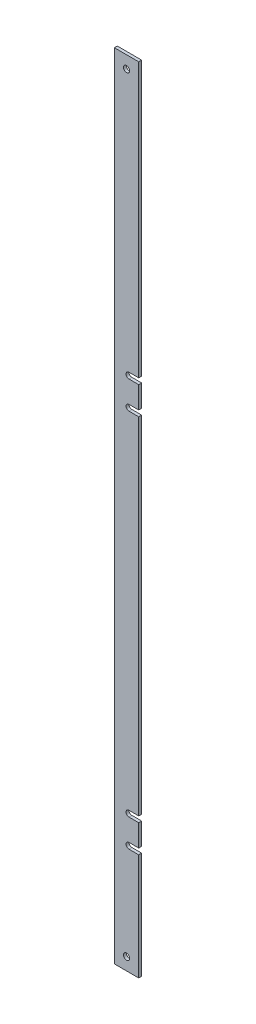
from build123d import *

# Parameters (mm, degrees)
SKETCH1_W                       = 25
SKETCH1_H                       = 812.8
BOSS_EXTRUDE1_DEPTH             = 3
CUT_EXTRUDE4_DEPTH              = 10
F_1_4_0_25_DIAMETER_HOLE1_D     = 6.35
F_1_4_0_25_DIAMETER_HOLE1_DEPTH = 5.84
F_1_4_0_25_DIAMETER_HOLE1_TIP   = 1.907732465


with BuildPart() as part:
    # Sketch1 → Boss-Extrude1 (new body)
    with BuildSketch(Plane.XY):
        Rectangle(SKETCH1_W, SKETCH1_H)
    extrude(amount=BOSS_EXTRUDE1_DEPTH)

    # Sketch5 → Cut-Extrude4 (cut)
    with BuildSketch(Plane.XY.offset(3)):
        with BuildLine():
            Line((2.5, 125.980140029), (22.5, 125.980140029))
            ThreePointArc((22.5, 125.980140029), (25.5, 122.980140029), (22.5, 119.980140029))
            Line((22.5, 119.980140029), (2.5, 119.980140029))
            ThreePointArc((2.5, 119.980140029), (-0.5, 122.980140029), (2.5, 125.980140029))
        make_face()
        with BuildLine():
            Line((2.5, 97.480140029), (22.5, 97.480140029))
            ThreePointArc((22.5, 97.480140029), (25.5, 94.480140029), (22.5, 91.480140029))
            Line((22.5, 91.480140029), (2.5, 91.480140029))
            ThreePointArc((2.5, 91.480140029), (-0.5, 94.480140029), (2.5, 97.480140029))
        make_face()
        with BuildLine():
            Line((2.5, -262.629859971), (22.5, -262.629859971))
            ThreePointArc((22.5, -262.629859971), (25.5, -265.629859971), (22.5, -268.629859971))
            Line((22.5, -268.629859971), (2.5, -268.629859971))
            ThreePointArc((2.5, -268.629859971), (-0.5, -265.629859971), (2.5, -262.629859971))
        make_face()
        with BuildLine():
            Line((2.5, -291.129859971), (22.5, -291.129859971))
            ThreePointArc((22.5, -291.129859971), (25.5, -294.129859971), (22.5, -297.129859971))
            Line((22.5, -297.129859971), (2.5, -297.129859971))
            ThreePointArc((2.5, -297.129859971), (-0.5, -294.129859971), (2.5, -291.129859971))
        make_face()
    extrude(amount=-CUT_EXTRUDE4_DEPTH, mode=Mode.SUBTRACT)

    # 1/4 (0.25) Diameter Hole1
    with Locations(Plane.XY.offset(3)):
        with Locations((0, 393.7), (0, -393.7)):
            Hole(F_1_4_0_25_DIAMETER_HOLE1_D / 2, depth=F_1_4_0_25_DIAMETER_HOLE1_DEPTH)
            with Locations((0, 0, -(F_1_4_0_25_DIAMETER_HOLE1_DEPTH + F_1_4_0_25_DIAMETER_HOLE1_TIP / 2))):  # 118° drill point
                Cone(0, F_1_4_0_25_DIAMETER_HOLE1_D / 2, F_1_4_0_25_DIAMETER_HOLE1_TIP, mode=Mode.SUBTRACT)


solid = part.part
